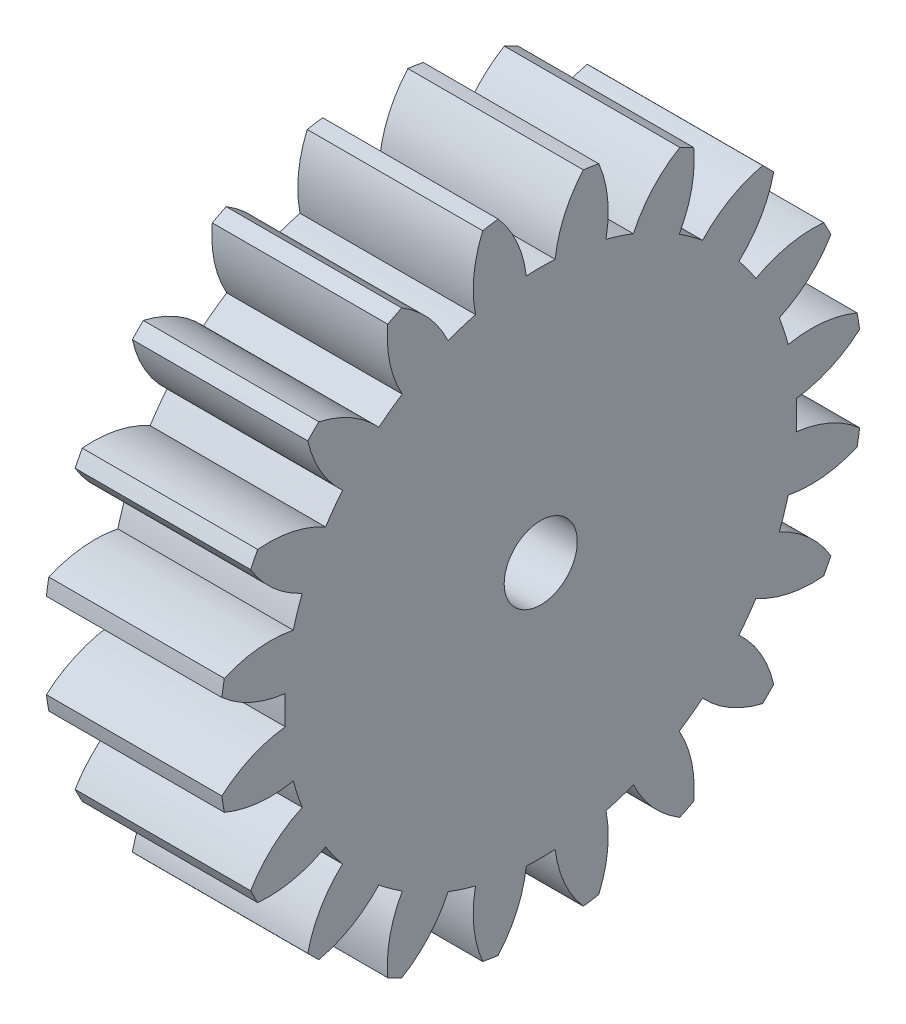
from build123d import *

# Parameters (mm, degrees)
BASPROSKE_W     = 12
BASPROSKE_H     = 22
TOOTHCUT_DEPTH  = 34.346664001
TEETHCUTS_COUNT = 20
TEETHCUTS_ANGLE = 342
BORSKE_R        = 2.5
BORE_DEPTH      = 50.0000508


with BuildPart() as part:
    # BasProSke → Base-Revolve (revolve)
    with BuildSketch(Plane(origin=(0, 0, 0), x_dir=(1, 0, 0), z_dir=(0, 1, 0)), mode=Mode.PRIVATE) as base_revolve_sk:
        with Locations((6, 11)):
            Rectangle(BASPROSKE_W, BASPROSKE_H)
    revolve(base_revolve_sk.sketch.rotate(Axis((-10, 0, 0), (1, 0, 0)), 180), axis=Axis((-10, 0, 0), (1, 0, 0)))

    # TooCutSke → ToothCut (cut, through all)
    with BuildSketch(Plane(origin=(0, 0, 0), x_dir=(0, 0, -1), z_dir=(1, 0, 0))):
        with BuildLine():
            ThreePointArc((0.986171591, 17.471189616), (0, 17.499), (-0.986171591, 17.471189616))
            ThreePointArc((-0.986171591, 17.471189616), (-1.626916196, 19.798789858), (-2.932850173, 21.829260982))
            ThreePointArc((-2.932850173, 21.829260982), (0, 22.0254), (2.932850173, 21.829260982))
            ThreePointArc((2.932850173, 21.829260982), (1.626916196, 19.798789858), (0.986171591, 17.471189616))
        make_face()
    toothcut = extrude(amount=TOOTHCUT_DEPTH, mode=Mode.SUBTRACT)

    # TeethCuts: ToothCut ×20 about axis
    teethcuts_axis = Axis((-10, 0, 0), (1, 0, 0))
    for i in range(1, TEETHCUTS_COUNT):
        add(toothcut.rotate(teethcuts_axis, i * TEETHCUTS_ANGLE / (TEETHCUTS_COUNT - 1)), mode=Mode.SUBTRACT)

    # BorSke → Bore (cut, symmetric)
    with BuildSketch(Plane(origin=(0, 0, 0), x_dir=(0, 0, -1), z_dir=(1, 0, 0))):
        with Locations(Location((0, 0, 0), (0, 0, 180))):
            Circle(BORSKE_R)
    extrude(amount=BORE_DEPTH, both=True, mode=Mode.SUBTRACT)


solid = part.part
